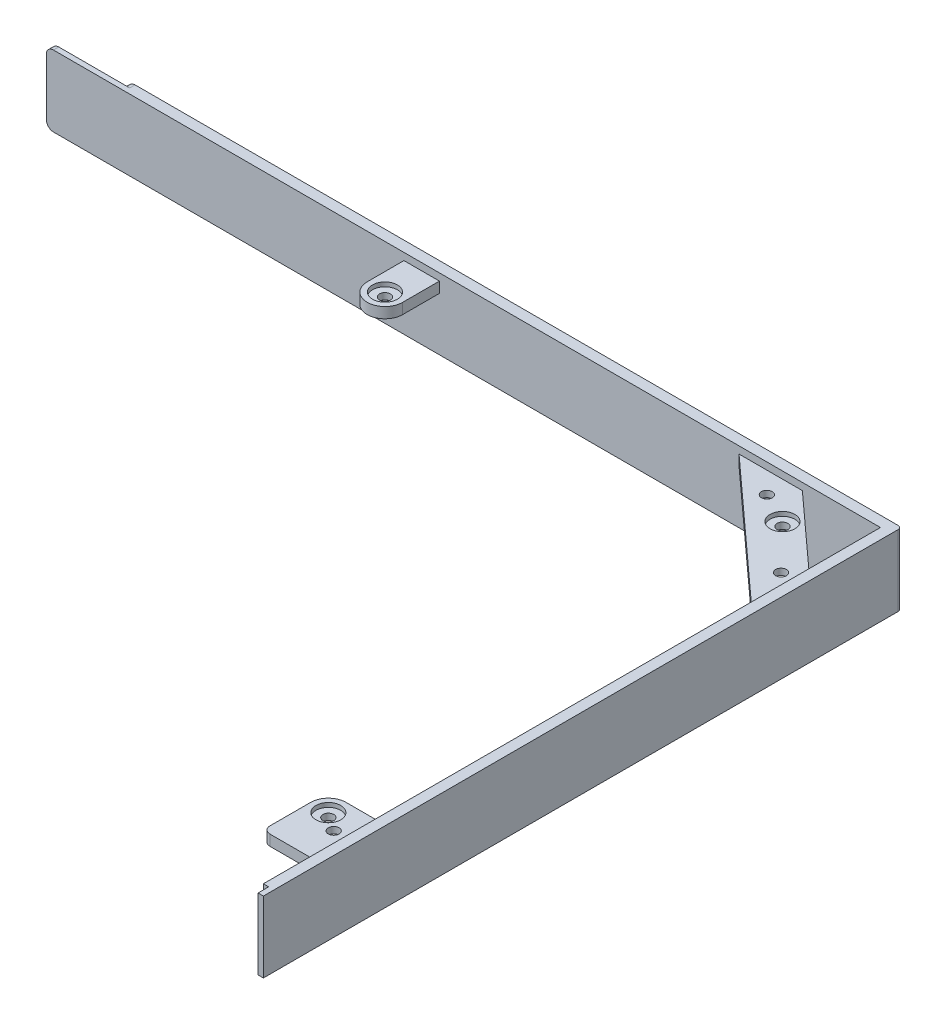
from build123d import *

# Parameters (mm, degrees)
EXTRUDE_1_DEPTH     = 20
EXTRUDE_START       = 1
SKETCH_2_R          = 1.525
EXTRUDE_2_DEPTH     = 3
CUT_EXTRUDE_1_REACH = 358.708
SKETCH_3_W          = 31
SKETCH_3_H          = 9.5
SKETCH_4_R          = 3.5
CUT_EXTRUDE_2_DEPTH = 1.2
CUT_EXTRUDE_3_REACH = 356.959
SKETCH_5_R          = 1.525
FILLET_1_R          = 1
FILLET_3_R          = 1
SKETCH_6_R          = 3.5
CUT_EXTRUDE_4_DEPTH = 1.2
SKETCH_7_W          = 69.4
SKETCH_7_H          = 20
CUT_EXTRUDE_5_DEPTH = 3
SKETCH_8_W          = 20
SKETCH_8_H          = 20
CUT_EXTRUDE_6_DEPTH = 1.5
FILLET_4_R          = 2
FILLET_5_R          = 2
FILLET_6_R          = 2


with BuildPart() as part:
    # 草图1 → 凸台-拉伸1 (new body)
    with BuildSketch(Plane(origin=(0, 0, 0), x_dir=(1, 0, 0), z_dir=(0, 1, 0))):
        Polygon((1.5, 0), (3, 0), (3, 173.85), (307.4, 173.85), (307.4, 176.85), (0, 176.85), (0, 0), (0, -3), (1.5, -3), align=None)
    extrude(amount=EXTRUDE_1_DEPTH)

    # 草图2 → 凸台-拉伸2 (add)
    # profile 1 of 3: a face of its own
    with BuildSketch(Plane(origin=(0, 14, 0), x_dir=(1, 0, 0), z_dir=(0, 1, 0)).offset(EXTRUDE_START)):
        Polygon((3, 153.85), (25, 173.85), (42.839282497, 173.85), (3, 137.632470457), align=None)
        with Locations(Location((20.25, 163.5, 0), (0, 0, 270))):
            Circle(SKETCH_2_R, mode=Mode.SUBTRACT)
    # profile 2 of 3: a face of its own
    with BuildSketch(Plane(origin=(0, 14, 0), x_dir=(1, 0, 0), z_dir=(0, 1, 0)).offset(EXTRUDE_START)):
        with BuildLine():
            Line((137.25, 163.5), (137.25, 173.85))
            Line((137.25, 173.85), (127.25, 173.85))
            Line((127.25, 173.85), (127.25, 163.5))
            ThreePointArc((127.25, 163.5), (132.25, 158.5), (137.25, 163.5))
        make_face()
        with Locations(Location((132.25, 163.5, 0), (0, 0, 270))):
            Circle(SKETCH_2_R, mode=Mode.SUBTRACT)
    # profile 3 of 3: a face of its own
    with BuildSketch(Plane(origin=(0, 14, 0), x_dir=(1, 0, 0), z_dir=(0, 1, 0)).offset(EXTRUDE_START)):
        with BuildLine():
            Line((3, 23.870342351), (3, 33.5))
            Line((3, 33.5), (13.2, 33.5))
            ThreePointArc((13.2, 33.5), (16.735533906, 32.035533906), (18.2, 28.5))
            Line((18.2, 28.5), (18.2, 15.043961292))
            Line((18.2, 15.043961292), (3, 15.043961292))
            Line((3, 15.043961292), (3, 23.870342351))
        make_face()
        with Locations(Location((13.2, 28.5, 0), (0, 0, 270))):
            Circle(SKETCH_2_R, mode=Mode.SUBTRACT)
    extrude(amount=EXTRUDE_2_DEPTH)

    # 草图3 → 切除-拉伸1 (cut, up to next)
    with BuildSketch(Plane(origin=(0, 0, -176.85), x_dir=(-1, 0, 0), z_dir=(0, 0, -1)), mode=Mode.PRIVATE) as cut_extrude_1_sk1:
        with Locations((-291.9, 15.25)):
            Rectangle(SKETCH_3_W, SKETCH_3_H)
    cut_extrude_1_tool1 = extrude(cut_extrude_1_sk1.sketch, amount=-CUT_EXTRUDE_1_REACH, mode=Mode.PRIVATE) & part.part
    add(cut_extrude_1_tool1.solids().sort_by_distance((291.9, 15.25, -176.85))[0], mode=Mode.SUBTRACT)

    # 草图4 → 切除-拉伸2 (cut)
    with BuildSketch(Plane(origin=(0, 18, 0), x_dir=(1, 0, 0), z_dir=(0, 1, 0))):
        with Locations(Location((13.2, 28.5, 0), (0, 0, 270))):
            Circle(SKETCH_4_R)
        with Locations(Location((20.25, 163.5, 0), (0, 0, 270))):
            Circle(SKETCH_4_R)
        with Locations(Location((132.25, 163.5, 0), (0, 0, 270))):
            Circle(SKETCH_4_R)
    extrude(amount=-CUT_EXTRUDE_2_DEPTH, mode=Mode.SUBTRACT)

    # 草图5 → 切除-拉伸3 (cut, up to next)
    with BuildSketch(Plane.XZ.offset(-15), mode=Mode.PRIVATE) as cut_extrude_3_sk1:
        with Locations(Location((29, -167.85, 0), (0, 0, 270))):
            Circle(SKETCH_5_R)
    cut_extrude_3_tool1 = extrude(cut_extrude_3_sk1.sketch, amount=-CUT_EXTRUDE_3_REACH, mode=Mode.PRIVATE) & part.part
    # 草图5 → 切除-拉伸3 (cut, up to next)
    with BuildSketch(Plane.XZ.offset(-15), mode=Mode.PRIVATE) as cut_extrude_3_sk2:
        with Locations(Location((8, -150.85, 0), (0, 0, 270))):
            Circle(SKETCH_5_R)
    cut_extrude_3_tool2 = extrude(cut_extrude_3_sk2.sketch, amount=-CUT_EXTRUDE_3_REACH, mode=Mode.PRIVATE) & part.part
    # 草图5 → 切除-拉伸3 (cut, up to next)
    with BuildSketch(Plane.XZ.offset(-15), mode=Mode.PRIVATE) as cut_extrude_3_sk3:
        with Locations(Location((8, -24.8, 0), (0, 0, 270))):
            Circle(SKETCH_5_R)
    cut_extrude_3_tool3 = extrude(cut_extrude_3_sk3.sketch, amount=-CUT_EXTRUDE_3_REACH, mode=Mode.PRIVATE) & part.part
    add(cut_extrude_3_tool1.solids().sort_by_distance((29, 15, -167.85))[0], mode=Mode.SUBTRACT)
    add(cut_extrude_3_tool2.solids().sort_by_distance((8, 15, -150.85))[0], mode=Mode.SUBTRACT)
    add(cut_extrude_3_tool3.solids().sort_by_distance((8, 15, -24.8))[0], mode=Mode.SUBTRACT)

    # 圆角1
    fillet_1_edges = [part.edges().sort_by_distance(p)[0] for p in [
        (0, 10, -176.85),
    ]]
    fillet(fillet_1_edges, radius=FILLET_1_R)

    # 圆角3
    fillet_3_edges = [part.edges().sort_by_distance(p)[0] for p in [
        (276.4, 10.5, -175.35),
    ]]
    fillet(fillet_3_edges, radius=FILLET_3_R)

    # 草图6 → 切除-拉伸4 (cut)
    with BuildSketch(Plane.XZ.offset(-15)):
        with Locations(Location((8, -24.8, 0), (0, 0, 270))):
            Circle(SKETCH_6_R)
        with Locations(Location((8, -150.85, 0), (0, 0, 270))):
            Circle(SKETCH_6_R)
        with Locations(Location((29, -167.85, 0), (0, 0, 270))):
            Circle(SKETCH_6_R)
    extrude(amount=-CUT_EXTRUDE_4_DEPTH, mode=Mode.SUBTRACT)

    # 草图7 → 切除-拉伸5 (cut)
    with BuildSketch(Plane(origin=(0, 0, -176.85), x_dir=(-1, 0, 0), z_dir=(0, 0, -1))):
        with Locations((-272.7, 10)):
            Rectangle(SKETCH_7_W, SKETCH_7_H)
    extrude(amount=-CUT_EXTRUDE_5_DEPTH, mode=Mode.SUBTRACT)


with BuildPart() as body_2:
    # 镜向3: mirrored copy
    add(part.part.mirror(Plane(origin=(317.4, 0, 0), x_dir=(0, 0, 1), z_dir=(1, 0, 0))))

    # 草图8 → 切除-拉伸6 (cut)
    with BuildSketch(Plane(origin=(0, 0, -176.85), x_dir=(-1, 0, 0), z_dir=(0, 0, -1))):
        with Locations((-406.8, 10)):
            Rectangle(SKETCH_8_W, SKETCH_8_H)
    extrude(amount=-CUT_EXTRUDE_6_DEPTH, mode=Mode.SUBTRACT)

    # 圆角4
    fillet_4_edges = [body_2.edges().sort_by_distance(p)[0] for p in [
        (416.8, 0, -176.1),
        (416.8, 20, -176.1),
    ]]
    fillet(fillet_4_edges, radius=FILLET_4_R)

    # 圆角5
    fillet_5_edges = [body_2.edges().sort_by_distance(p)[0] for p in [
        (396.8, 20, -174.6),
        (396.8, 0, -174.6),
    ]]
    fillet(fillet_5_edges, radius=FILLET_5_R)

    # 圆角6
    fillet_6_edges = [body_2.edges().sort_by_distance(p)[0] for p in [
        (616.6, 16.5, -15.043961292),
    ]]
    fillet(fillet_6_edges, radius=FILLET_6_R)


solid = body_2.part
